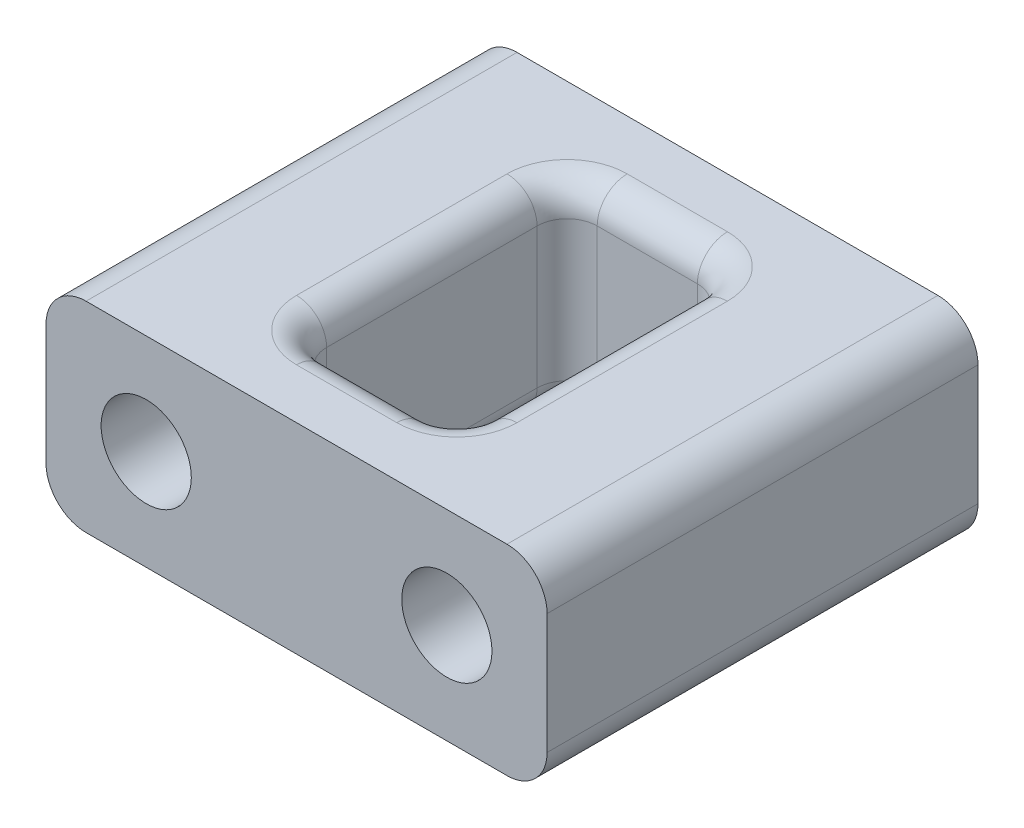
from build123d import *

# Parameters (mm, degrees)
SKETCH_1_W          = 25
SKETCH_1_H          = 10
SKETCH_1_R          = 2.25
EXTRUDE_1_DEPTH     = 21.5
FILLET_1_R          = 2
SKETCH_2_W          = 8
SKETCH_2_H          = 13.5
CUT_EXTRUDE_1_DEPTH = 35.456494308
FILLET_2_R          = 1.5


with BuildPart() as part:
    # 草图1 → 凸台-拉伸1 (new body)
    with BuildSketch(Plane.XY):
        with Locations((12.5, 5)):
            Rectangle(SKETCH_1_W, SKETCH_1_H)
        with Locations((5, 5)):
            Circle(SKETCH_1_R, mode=Mode.SUBTRACT)
        with Locations((20, 5)):
            Circle(SKETCH_1_R, mode=Mode.SUBTRACT)
    extrude(amount=EXTRUDE_1_DEPTH)

    # 圆角1
    fillet_1_edges = [part.edges().sort_by_distance(p)[0] for p in [
        (0, 10, 10.75),
        (25, 10, 10.75),
        (25, 0, 10.75),
        (0, 0, 10.75),
    ]]
    fillet(fillet_1_edges, radius=FILLET_1_R)

    # 草图2 → 切除-拉伸1 (cut, through all)
    with BuildSketch(Plane(origin=(0, 10, 0), x_dir=(1, 0, 0), z_dir=(0, 1, 0))):
        with Locations((12.5, -10.75)):
            Rectangle(SKETCH_2_W, SKETCH_2_H)
    extrude(amount=-CUT_EXTRUDE_1_DEPTH, mode=Mode.SUBTRACT)

    # 圆角2
    fillet_2_edges = [part.edges().sort_by_distance(p)[0] for p in [
        (8.5, 0, 10.75),
        (8.5, 5, 17.5),
        (12.5, 0, 4),
        (8.5, 5, 4),
        (16.5, 0, 10.75),
        (16.5, 5, 4),
        (12.5, 0, 17.5),
        (16.5, 5, 17.5),
        (8.5, 10, 10.75),
        (12.5, 10, 17.5),
        (16.5, 10, 10.75),
        (12.5, 10, 4),
    ]]
    fillet(fillet_2_edges, radius=FILLET_2_R)


solid = part.part
